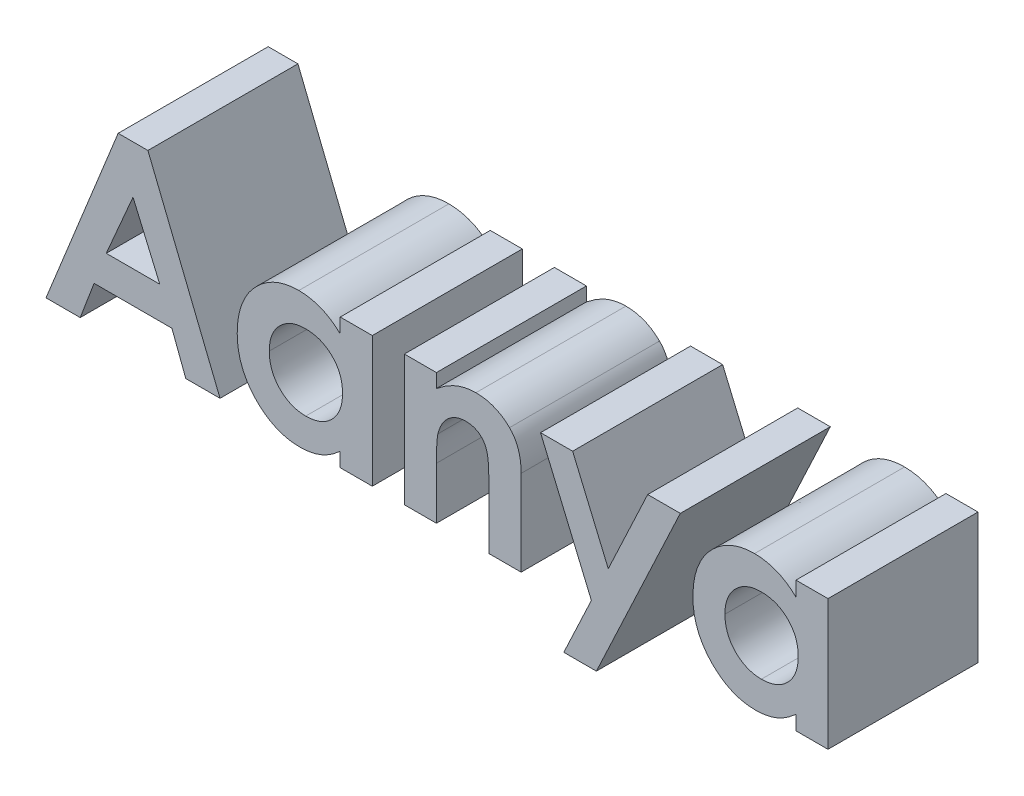
from build123d import *

# Parameters (mm, degrees)
BOSS_EXTRUDE1_DEPTH   = 4
BOSS_EXTRUDE1_2_DEPTH = 4
BOSS_EXTRUDE1_3_DEPTH = 4
BOSS_EXTRUDE1_4_DEPTH = 4
BOSS_EXTRUDE1_5_DEPTH = 4


with BuildPart() as part:
    # Sketch1 → Boss-Extrude1 (new body)
    with BuildSketch(Plane.XY):
        Polygon((-10.87449872, -1.789699215), (-8.950227386, 2.972800785), (-8.157431413, 2.972800785), (-6.234114105, -1.789699215), (-7.14711741, -1.789699215), (-7.51727967, -0.812776138), (-9.592287182, -0.812776138), (-9.962449441, -1.789699215), align=None)
        Polygon((-7.840694634, 0.042031554), (-8.554306413, 1.695359379), (-9.267918191, 0.042031554), align=None, mode=Mode.SUBTRACT)
    extrude(amount=BOSS_EXTRUDE1_DEPTH)


with BuildPart() as body_2:
    # Sketch1 → Boss-Extrude1 2 (new body)
    with BuildSketch(Plane.XY):
        with BuildLine():
            add(Edge.make_bspline(
                [(-4.132393853, 1.751646939), (-4.029617531, 1.75284636), (-3.87724318, 1.737636457), (-3.680277724, 1.690153054), (-3.539162431, 1.640290756), (-3.402293036, 1.577169856), (-3.225809094, 1.470547315), (-3.10378304, 1.372262841), (-3.028585259, 1.298484379)],
                knots=[0, 0, 0, 0, 0.251537451, 0.373434128, 0.49566655, 0.617680221, 0.742091207, 1, 1, 1, 1], degree=3))
            Line((-3.028585259, 1.298484379), (-3.028585259, 1.690589247))
            Line((-3.028585259, 1.690589247), (-2.173777566, 1.690589247))
            Line((-2.173777566, 1.690589247), (-2.173777566, -1.789699215))
            Line((-2.173777566, -1.789699215), (-3.028585259, -1.789699215))
            Line((-3.028585259, -1.789699215), (-3.028585259, -1.409996691))
            add(Edge.make_bspline(
                [(-3.028585259, -1.409996691), (-3.109448543, -1.483031206), (-3.234126455, -1.583244659), (-3.412593084, -1.688515593), (-3.543477845, -1.749694875), (-3.677403568, -1.794800721), (-3.863696865, -1.839159605), (-4.008946987, -1.850101953), (-4.106635139, -1.850756907)],
                knots=[0, 0, 0, 0, 0.273943506, 0.399987178, 0.519718967, 0.636176176, 0.754371141, 1, 1, 1, 1], degree=3))
            add(Edge.make_bspline(
                [(-4.106635139, -1.850756907), (-4.216826962, -1.851939406), (-4.380188984, -1.835071091), (-4.590328363, -1.780938657), (-4.740744197, -1.724495935), (-4.885197774, -1.651242175), (-5.024795258, -1.56320685), (-5.157143319, -1.457266848), (-5.283343863, -1.338014799), (-5.398892017, -1.206836124), (-5.49990641, -1.065552185), (-5.585049993, -0.916166859), (-5.654818554, -0.759174501), (-5.709644482, -0.594693991), (-5.762819244, -0.361259877), (-5.775762749, -0.179109778), (-5.776181413, -0.056233169)],
                knots=[0, 0, 0, 0, 0.121092325, 0.179634237, 0.238303512, 0.297437091, 0.357506849, 0.419513154, 0.483600041, 0.548295031, 0.611486872, 0.674312645, 0.737107248, 0.800159515, 0.864737133, 1, 1, 1, 1], degree=3))
            add(Edge.make_bspline(
                [(-5.776181413, -0.056233169), (-5.775176048, 0.070341564), (-5.763751685, 0.257877811), (-5.71143136, 0.4978854), (-5.659114819, 0.665683147), (-5.591761783, 0.82454214), (-5.509744437, 0.974717685), (-5.411931694, 1.115818508), (-5.299220809, 1.245442767), (-5.177520506, 1.364249283), (-5.0473227, 1.467681181), (-4.910663602, 1.555546359), (-4.767396986, 1.627296749), (-4.617547075, 1.682674679), (-4.407383633, 1.737605648), (-4.242994424, 1.751752735), (-4.132393853, 1.751646939)],
                knots=[0, 0, 0, 0, 0.139308968, 0.205473642, 0.26959838, 0.332253223, 0.394830003, 0.45737553, 0.520581844, 0.583374035, 0.644082429, 0.703039519, 0.761664045, 0.819843943, 0.878346403, 1, 1, 1, 1], degree=3))
        make_face()
        with BuildLine():
            add(Edge.make_bspline(
                [(-2.967527566, -0.04001472), (-2.968759837, 0.030726506), (-2.974681464, 0.13560595), (-3.005005958, 0.269692293), (-3.035144594, 0.363176707), (-3.07460668, 0.451317595), (-3.12393818, 0.533133903), (-3.179911435, 0.611461245), (-3.246089993, 0.681914951), (-3.317135364, 0.747370715), (-3.394682425, 0.803331236), (-3.476287737, 0.85155825), (-3.562453867, 0.891159355), (-3.653974172, 0.920170348), (-3.783365466, 0.950775684), (-3.884852353, 0.956651686), (-3.953036881, 0.957896939)],
                knots=[0, 0, 0, 0, 0.135095843, 0.199062931, 0.26154836, 0.322044302, 0.382646423, 0.443384787, 0.505154721, 0.566515904, 0.627254268, 0.687026267, 0.746970113, 0.807538884, 0.869732605, 1, 1, 1, 1], degree=3))
            add(Edge.make_bspline(
                [(-3.953036881, 0.957896939), (-4.019715924, 0.956847325), (-4.118766217, 0.950262908), (-4.245863706, 0.92075671), (-4.334671924, 0.888703368), (-4.419787219, 0.849629409), (-4.499914683, 0.800697564), (-4.575716269, 0.742859192), (-4.646746033, 0.677516741), (-4.711500064, 0.605693322), (-4.767322083, 0.52731837), (-4.81476079, 0.444503959), (-4.854885313, 0.356999758), (-4.88359161, 0.263775454), (-4.914487968, 0.131253669), (-4.919855257, 0.027174003), (-4.92137372, -0.042876799)],
                knots=[0, 0, 0, 0, 0.128420809, 0.189995948, 0.250359009, 0.30974405, 0.369855539, 0.430536995, 0.492876096, 0.555257199, 0.616197084, 0.67757746, 0.738630831, 0.800921896, 0.864881541, 1, 1, 1, 1], degree=3))
            add(Edge.make_bspline(
                [(-4.92137372, -0.042876799), (-4.920106261, -0.113645316), (-4.914006344, -0.218423763), (-4.884215883, -0.352792687), (-4.852242311, -0.446404394), (-4.813171733, -0.535729434), (-4.765620179, -0.620352595), (-4.70720978, -0.698778396), (-4.642399009, -0.772862518), (-4.569912067, -0.839016562), (-4.493681597, -0.897756049), (-4.412666306, -0.946900569), (-4.327745201, -0.986629663), (-4.239203983, -1.018967498), (-4.113293305, -1.048068944), (-4.015412547, -1.056716157), (-3.949220776, -1.057006907)],
                knots=[0, 0, 0, 0, 0.135364742, 0.199460916, 0.262263612, 0.323991109, 0.385461119, 0.447170687, 0.510418175, 0.573170928, 0.634270788, 0.693953647, 0.753722967, 0.813083582, 0.873628543, 1, 1, 1, 1], degree=3))
            add(Edge.make_bspline(
                [(-3.949220776, -1.057006907), (-3.881286874, -1.05587761), (-3.780629344, -1.049532988), (-3.651632641, -1.01988276), (-3.561631851, -0.987644291), (-3.475340372, -0.948851138), (-3.393539597, -0.900875373), (-3.317116482, -0.843169755), (-3.245684141, -0.777236598), (-3.180230251, -0.704826694), (-3.12363621, -0.625423999), (-3.074341962, -0.541568228), (-3.035569728, -0.451275823), (-3.004796673, -0.356129933), (-2.974696763, -0.219395659), (-2.968827934, -0.112348016), (-2.967527566, -0.04001472)],
                knots=[0, 0, 0, 0, 0.128661741, 0.189789734, 0.249707447, 0.309188905, 0.368499841, 0.428643518, 0.489936978, 0.552121002, 0.612878024, 0.674050383, 0.735729182, 0.798304624, 0.862952782, 1, 1, 1, 1], degree=3))
        make_face(mode=Mode.SUBTRACT)
    extrude(amount=BOSS_EXTRUDE1_2_DEPTH)


with BuildPart() as body_3:
    # Sketch1 → Boss-Extrude1 3 (new body)
    with BuildSketch(Plane.XY):
        with BuildLine():
            add(Edge.make_bspline(
                [(-0.424093071, 0.295802588), (-0.433082411, 0.261367741), (-0.439672028, 0.202869663), (-0.450244374, 0.117595667), (-0.453586585, 0.035974872), (-0.459280642, -0.05744191), (-0.46229677, -0.205693884), (-0.464104368, -0.322706873), (-0.464162182, -0.404452821)],
                knots=[0, 0, 0, 0, 0.151475868, 0.251213212, 0.366854146, 0.500124386, 0.650932297, 1, 1, 1, 1], degree=3))
            Line((-0.464162182, -0.404452821), (-0.464162182, -1.789699215))
            Line((-0.464162182, -1.789699215), (-1.318969874, -1.789699215))
            Line((-1.318969874, -1.789699215), (-1.318969874, 1.690589247))
            Line((-1.318969874, 1.690589247), (-0.464162182, 1.690589247))
            Line((-0.464162182, 1.690589247), (-0.464162182, 1.32233504))
            add(Edge.make_bspline(
                [(-0.464162182, 1.32233504), (-0.372284149, 1.396427608), (-0.234413337, 1.494882211), (-0.046763752, 1.600819847), (0.081977273, 1.658403575), (0.20819473, 1.699742057), (0.375441967, 1.739587939), (0.503640723, 1.752165486), (0.58908301, 1.751646939)],
                knots=[0, 0, 0, 0, 0.30498931, 0.436681429, 0.556242249, 0.668759084, 0.77937854, 1, 1, 1, 1], degree=3))
            add(Edge.make_bspline(
                [(0.58908301, 1.751646939), (0.67389877, 1.750679465), (0.800369908, 1.742542434), (0.962053686, 1.702874319), (1.077375343, 1.664087921), (1.187264028, 1.612828663), (1.329794936, 1.53105809), (1.424694358, 1.450192155), (1.48491384, 1.392932997)],
                knots=[0, 0, 0, 0, 0.257369373, 0.381171348, 0.503298819, 0.625247689, 0.747811067, 1, 1, 1, 1], degree=3))
            add(Edge.make_bspline(
                [(1.48491384, 1.392932997), (1.536640647, 1.341642756), (1.605293207, 1.254576914), (1.676335975, 1.123422948), (1.720538071, 1.015066739), (1.753133786, 0.896726724), (1.78769193, 0.722708226), (1.794441929, 0.585654563), (1.794972434, 0.492332035)],
                knots=[0, 0, 0, 0, 0.223210024, 0.337545587, 0.456528166, 0.581243817, 0.713405156, 1, 1, 1, 1], degree=3))
            Line((1.794972434, 0.492332035), (1.794972434, -1.789699215))
            Line((1.794972434, -1.789699215), (0.940164741, -1.789699215))
            Line((0.940164741, -1.789699215), (0.940164741, -0.27852133))
            add(Edge.make_bspline(
                [(0.940164741, -0.27852133), (0.939921239, -0.184077615), (0.939080459, -0.048831759), (0.931783307, 0.122504308), (0.927051186, 0.231720565), (0.917756956, 0.327676198), (0.909375633, 0.410978362), (0.896515184, 0.480871387), (0.879781673, 0.556051871), (0.850560852, 0.636546034), (0.805196878, 0.721361146), (0.747646574, 0.793409386), (0.680259405, 0.853215359), (0.603113976, 0.900472865), (0.485188687, 0.946352258), (0.388504577, 0.958169957), (0.322909633, 0.957896939)],
                knots=[0, 0, 0, 0, 0.179518406, 0.256936513, 0.325929829, 0.387212867, 0.440139084, 0.484952067, 0.522188202, 0.586422033, 0.647003712, 0.704201966, 0.760716033, 0.817414001, 0.87521257, 1, 1, 1, 1], degree=3))
            add(Edge.make_bspline(
                [(0.322909633, 0.957896939), (0.236413259, 0.957004272), (0.106145203, 0.937950497), (-0.049350393, 0.861482108), (-0.153556015, 0.783390983), (-0.245518813, 0.686851638), (-0.349960397, 0.528819164), (-0.400837931, 0.392084047), (-0.424093071, 0.295802588)],
                knots=[0, 0, 0, 0, 0.240657962, 0.35738999, 0.477137096, 0.600008858, 0.725224946, 1, 1, 1, 1], degree=3))
        make_face()
    extrude(amount=BOSS_EXTRUDE1_3_DEPTH)


with BuildPart() as body_4:
    # Sketch1 → Boss-Extrude1 4 (new body)
    with BuildSketch(Plane.XY):
        Polygon((3.66772634, -1.506353361), (2.312054765, 1.690589247), (3.167816484, 1.690589247), (4.118026821, -0.548510813), (5.16936396, 1.690589247), (6.038482049, 1.690589247), (3.801290042, -3.071910753), (2.932171953, -3.071910753), align=None)
    extrude(amount=BOSS_EXTRUDE1_4_DEPTH)


with BuildPart() as body_5:
    # Sketch1 → Boss-Extrude1 5 (new body)
    with BuildSketch(Plane.XY):
        with BuildLine():
            add(Edge.make_bspline(
                [(8.018086917, 1.751646939), (8.120863238, 1.75284636), (8.273237589, 1.737636457), (8.470203045, 1.690153054), (8.611318339, 1.640290756), (8.748187733, 1.577169856), (8.924671676, 1.470547315), (9.04669773, 1.372262841), (9.12189551, 1.298484379)],
                knots=[0, 0, 0, 0, 0.251537451, 0.373434128, 0.49566655, 0.617680221, 0.742091207, 1, 1, 1, 1], degree=3))
            Line((9.12189551, 1.298484379), (9.12189551, 1.690589247))
            Line((9.12189551, 1.690589247), (9.976703203, 1.690589247))
            Line((9.976703203, 1.690589247), (9.976703203, -1.789699215))
            Line((9.976703203, -1.789699215), (9.12189551, -1.789699215))
            Line((9.12189551, -1.789699215), (9.12189551, -1.409996691))
            add(Edge.make_bspline(
                [(9.12189551, -1.409996691), (9.041032226, -1.483031206), (8.916354315, -1.583244659), (8.737887685, -1.688515593), (8.607002924, -1.749694875), (8.473077201, -1.794800721), (8.286783904, -1.839159605), (8.141533782, -1.850101953), (8.043845631, -1.850756907)],
                knots=[0, 0, 0, 0, 0.273943506, 0.399987178, 0.519718967, 0.636176176, 0.754371141, 1, 1, 1, 1], degree=3))
            add(Edge.make_bspline(
                [(8.043845631, -1.850756907), (7.933653807, -1.851939406), (7.770291785, -1.835071091), (7.560152406, -1.780938657), (7.409736572, -1.724495935), (7.265282995, -1.651242175), (7.125685512, -1.56320685), (6.99333745, -1.457266848), (6.867136906, -1.338014799), (6.751588752, -1.206836124), (6.650574359, -1.065552185), (6.565430776, -0.916166859), (6.495662215, -0.759174501), (6.440836287, -0.594693991), (6.387661525, -0.361259877), (6.37471802, -0.179109778), (6.374299357, -0.056233169)],
                knots=[0, 0, 0, 0, 0.121092325, 0.179634237, 0.238303512, 0.297437091, 0.357506849, 0.419513154, 0.483600041, 0.548295031, 0.611486872, 0.674312645, 0.737107248, 0.800159515, 0.864737133, 1, 1, 1, 1], degree=3))
            add(Edge.make_bspline(
                [(6.374299357, -0.056233169), (6.375304721, 0.070341564), (6.386729085, 0.257877811), (6.439049409, 0.4978854), (6.49136595, 0.665683147), (6.558718986, 0.82454214), (6.640736332, 0.974717685), (6.738549075, 1.115818508), (6.85125996, 1.245442767), (6.972960263, 1.364249283), (7.103158069, 1.467681181), (7.239817167, 1.555546359), (7.383083783, 1.627296749), (7.532933695, 1.682674679), (7.743097136, 1.737605648), (7.907486345, 1.751752735), (8.018086917, 1.751646939)],
                knots=[0, 0, 0, 0, 0.139308968, 0.205473642, 0.26959838, 0.332253223, 0.394830003, 0.45737553, 0.520581844, 0.583374035, 0.644082429, 0.703039519, 0.761664045, 0.819843943, 0.878346403, 1, 1, 1, 1], degree=3))
        make_face()
        with BuildLine():
            add(Edge.make_bspline(
                [(9.182953203, -0.04001472), (9.181720932, 0.030726506), (9.175799305, 0.13560595), (9.145474811, 0.269692293), (9.115336176, 0.363176707), (9.075874089, 0.451317595), (9.026542589, 0.533133903), (8.970569335, 0.611461245), (8.904390777, 0.681914951), (8.833345405, 0.747370715), (8.755798344, 0.803331236), (8.674193032, 0.85155825), (8.588026902, 0.891159355), (8.496506597, 0.920170348), (8.367115303, 0.950775684), (8.265628416, 0.956651686), (8.197443888, 0.957896939)],
                knots=[0, 0, 0, 0, 0.135095843, 0.199062931, 0.26154836, 0.322044302, 0.382646423, 0.443384787, 0.505154721, 0.566515904, 0.627254268, 0.687026267, 0.746970113, 0.807538884, 0.869732605, 1, 1, 1, 1], degree=3))
            add(Edge.make_bspline(
                [(8.197443888, 0.957896939), (8.130764846, 0.956847325), (8.031714553, 0.950262908), (7.904617064, 0.92075671), (7.815808845, 0.888703368), (7.73069355, 0.849629409), (7.650566087, 0.800697564), (7.5747645, 0.742859192), (7.503734736, 0.677516741), (7.438980705, 0.605693322), (7.383158686, 0.52731837), (7.335719979, 0.444503959), (7.295595457, 0.356999758), (7.26688916, 0.263775454), (7.235992801, 0.131253669), (7.230625512, 0.027174003), (7.229107049, -0.042876799)],
                knots=[0, 0, 0, 0, 0.128420809, 0.189995948, 0.250359009, 0.30974405, 0.369855539, 0.430536995, 0.492876096, 0.555257199, 0.616197084, 0.67757746, 0.738630831, 0.800921896, 0.864881541, 1, 1, 1, 1], degree=3))
            add(Edge.make_bspline(
                [(7.229107049, -0.042876799), (7.230374508, -0.113645316), (7.236474425, -0.218423763), (7.266264886, -0.352792687), (7.298238458, -0.446404394), (7.337309036, -0.535729434), (7.38486059, -0.620352595), (7.44327099, -0.698778396), (7.50808176, -0.772862518), (7.580568702, -0.839016562), (7.656799172, -0.897756049), (7.737814463, -0.946900569), (7.822735568, -0.986629663), (7.911276786, -1.018967498), (8.037187464, -1.048068944), (8.135068222, -1.056716157), (8.201259994, -1.057006907)],
                knots=[0, 0, 0, 0, 0.135364742, 0.199460916, 0.262263612, 0.323991109, 0.385461119, 0.447170687, 0.510418175, 0.573170928, 0.634270788, 0.693953647, 0.753722967, 0.813083582, 0.873628543, 1, 1, 1, 1], degree=3))
            add(Edge.make_bspline(
                [(8.201259994, -1.057006907), (8.269193895, -1.05587761), (8.369851425, -1.049532988), (8.498848128, -1.01988276), (8.588848919, -0.987644291), (8.675140398, -0.948851138), (8.756941172, -0.900875373), (8.833364287, -0.843169755), (8.904796628, -0.777236598), (8.970250519, -0.704826694), (9.026844559, -0.625423999), (9.076138807, -0.541568228), (9.114911041, -0.451275823), (9.145684096, -0.356129933), (9.175784007, -0.219395659), (9.181652835, -0.112348016), (9.182953203, -0.04001472)],
                knots=[0, 0, 0, 0, 0.128661741, 0.189789734, 0.249707447, 0.309188905, 0.368499841, 0.428643518, 0.489936978, 0.552121002, 0.612878024, 0.674050383, 0.735729182, 0.798304624, 0.862952782, 1, 1, 1, 1], degree=3))
        make_face(mode=Mode.SUBTRACT)
    extrude(amount=BOSS_EXTRUDE1_5_DEPTH)


solid = Compound([part.part, body_2.part, body_3.part, body_4.part, body_5.part])
